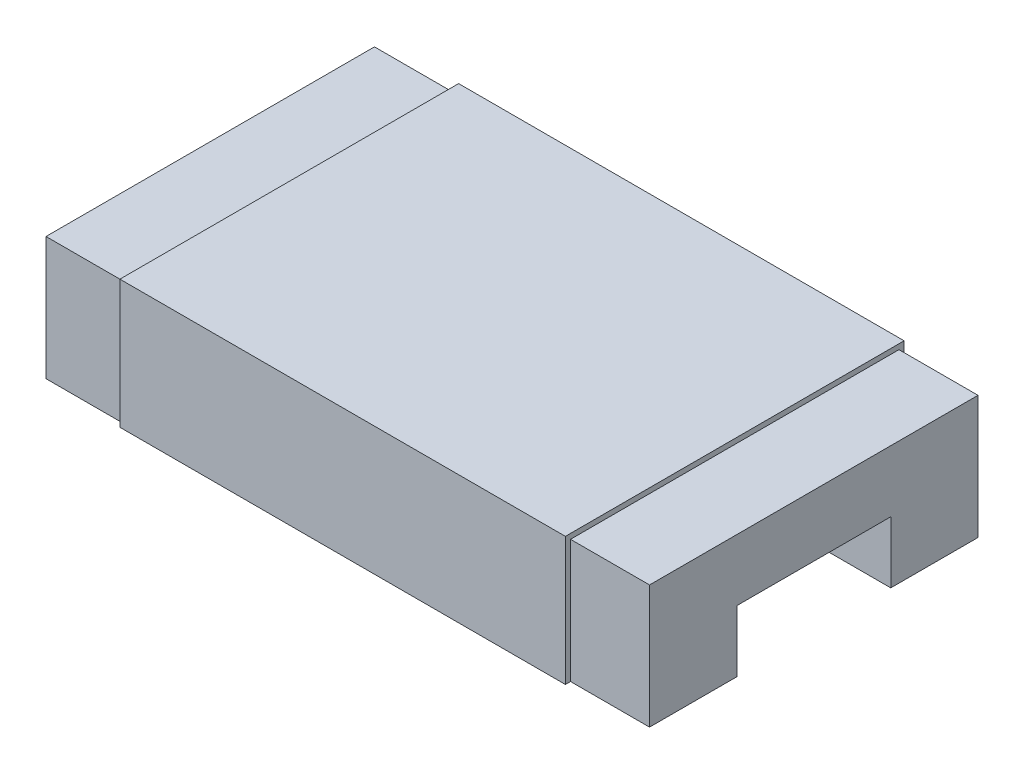
from build123d import *

# Parameters (mm, degrees)
BOSS_EXTRUDE1_DEPTH = 29.4
BOSS_EXTRUDE2_DEPTH = 21.7


with BuildPart() as part:
    # Sketch1 → Boss-Extrude1 (new, symmetric)
    with BuildSketch(Plane(origin=(0, 0, 0), x_dir=(0, 0, -1), z_dir=(1, 0, 0))):
        Polygon((-16, 6), (16, 6), (16, -6), (7.5, -6), (7.5, 0), (-7.5, 0), (-7.5, -6), (-16, -6), align=None)
    extrude(amount=BOSS_EXTRUDE1_DEPTH, both=True)

    # Sketch2 → Boss-Extrude2 (add, symmetric)
    with BuildSketch(Plane(origin=(0, 0, 0), x_dir=(0, 0, -1), z_dir=(1, 0, 0))):
        Polygon((-16, -6), (-16.5, -6), (-16.5, 6.5), (16.5, 6.5), (16.5, -6), (16, -6), (16, 6), (-16, 6), align=None)
    extrude(amount=BOSS_EXTRUDE2_DEPTH, both=True)


solid = part.part
